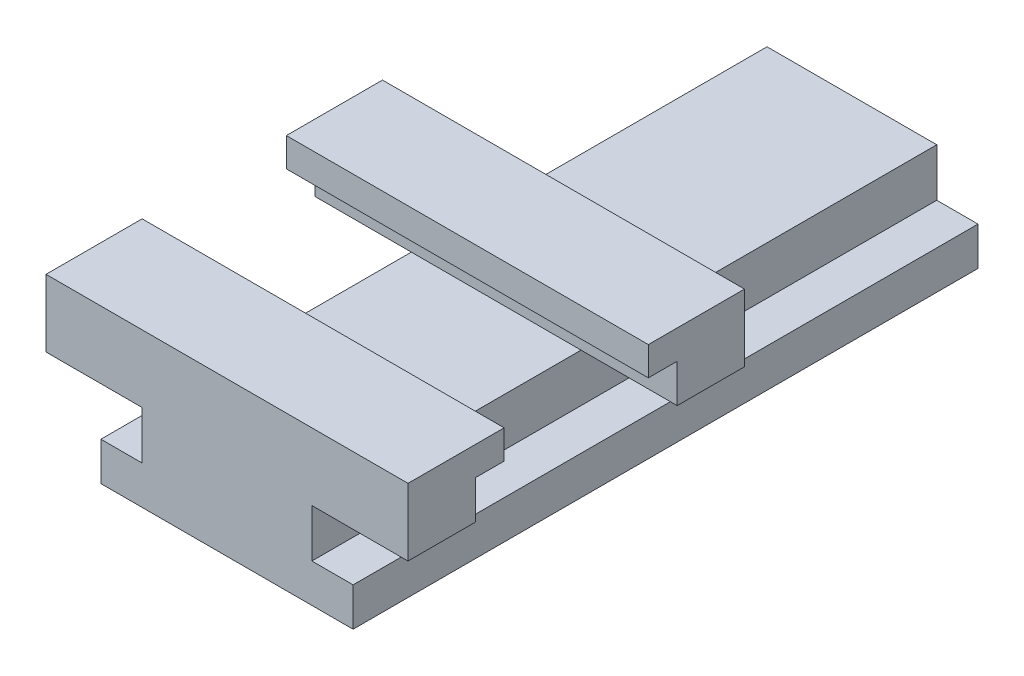
from build123d import *

# Parameters (mm, degrees)
BOSS_EXTRUDE1_DEPTH = 130
SKETCH3_W           = 75.312470342
SKETCH3_H           = 30
CUT_EXTRUDE1_DEPTH  = 14
SKETCH4_W           = 75.312470342
SKETCH4_H           = 60
CUT_EXTRUDE2_DEPTH  = 14
SKETCH5_W           = 6
SKETCH5_H           = 8
CUT_EXTRUDE3_DEPTH  = 94
SKETCH6_W           = 6
SKETCH6_H           = 8
CUT_EXTRUDE4_DEPTH  = 94


with BuildPart() as part:
    # Sketch1 → Boss-Extrude1 (new body)
    with BuildSketch(Plane.XY):
        Polygon((37.656235171, 2), (37.656235171, 16), (-37.656235171, 16), (-37.656235171, 2), (-17.656235171, 2), (-17.656235171, -8), (-26.236747462, -8), (-26.236747462, -16), (0, -16), (26.236747462, -16), (26.236747462, -8), (17.656235171, -8), (17.656235171, 2), align=None)
    extrude(amount=BOSS_EXTRUDE1_DEPTH)

    # Sketch3 → Cut-Extrude1 (cut)
    with BuildSketch(Plane(origin=(0, 16, 0), x_dir=(1, 0, 0), z_dir=(0, 1, 0))):
        with Locations((0, -95)):
            Rectangle(SKETCH3_W, SKETCH3_H)
    extrude(amount=-CUT_EXTRUDE1_DEPTH, mode=Mode.SUBTRACT)

    # Sketch4 → Cut-Extrude2 (cut)
    with BuildSketch(Plane(origin=(0, 16, 0), x_dir=(1, 0, 0), z_dir=(0, 1, 0))):
        with Locations((0, -30)):
            Rectangle(SKETCH4_W, SKETCH4_H)
    extrude(amount=-CUT_EXTRUDE2_DEPTH, mode=Mode.SUBTRACT)

    # Sketch5 → Cut-Extrude3 (cut)
    with BuildSketch(Plane.ZY.offset(37.656235171)):
        with Locations((77, 6)):
            Rectangle(SKETCH5_W, SKETCH5_H)
    extrude(amount=-CUT_EXTRUDE3_DEPTH, mode=Mode.SUBTRACT)

    # Sketch6 → Cut-Extrude4 (cut)
    with BuildSketch(Plane.ZY.offset(37.656235171)):
        with Locations((113, 6)):
            Rectangle(SKETCH6_W, SKETCH6_H)
    extrude(amount=-CUT_EXTRUDE4_DEPTH, mode=Mode.SUBTRACT)


solid = part.part
